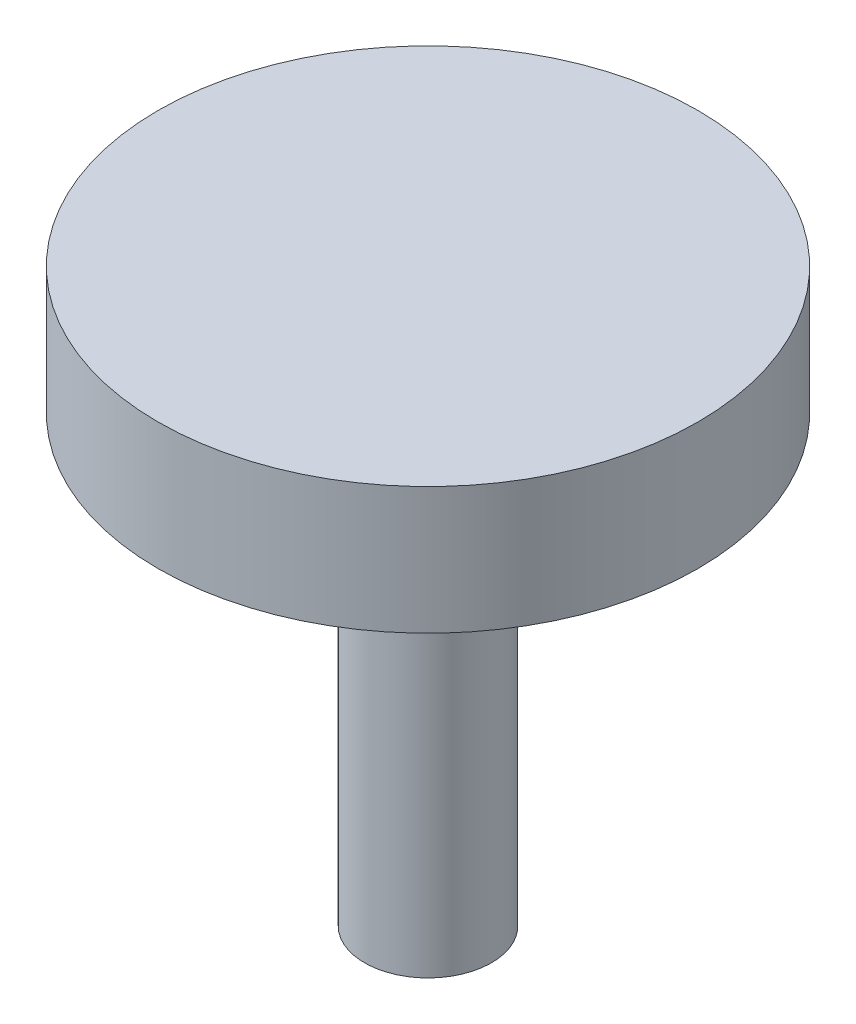
from build123d import *

# Parameters (mm, degrees)
SKETCH_1_R      = 42.5
EXTRUDE_1_DEPTH = 20
SKETCH_2_R      = 10
EXTRUDE_2_DEPTH = 70


with BuildPart() as part:
    # 草圖1 → 填料-伸長1 (new body)
    with BuildSketch(Plane(origin=(0, 0, 0), x_dir=(1, 0, 0), z_dir=(0, 1, 0))):
        with Locations(Location((0, 0, 0), (0, 0, 270))):
            Circle(SKETCH_1_R)
    extrude(amount=EXTRUDE_1_DEPTH)

    # 草圖2 → 填料-伸長2 (add)
    with BuildSketch(Plane.XZ):
        with Locations(Location((0, 0, 0), (0, 0, 270))):
            Circle(SKETCH_2_R)
    extrude(amount=EXTRUDE_2_DEPTH)


solid = part.part
